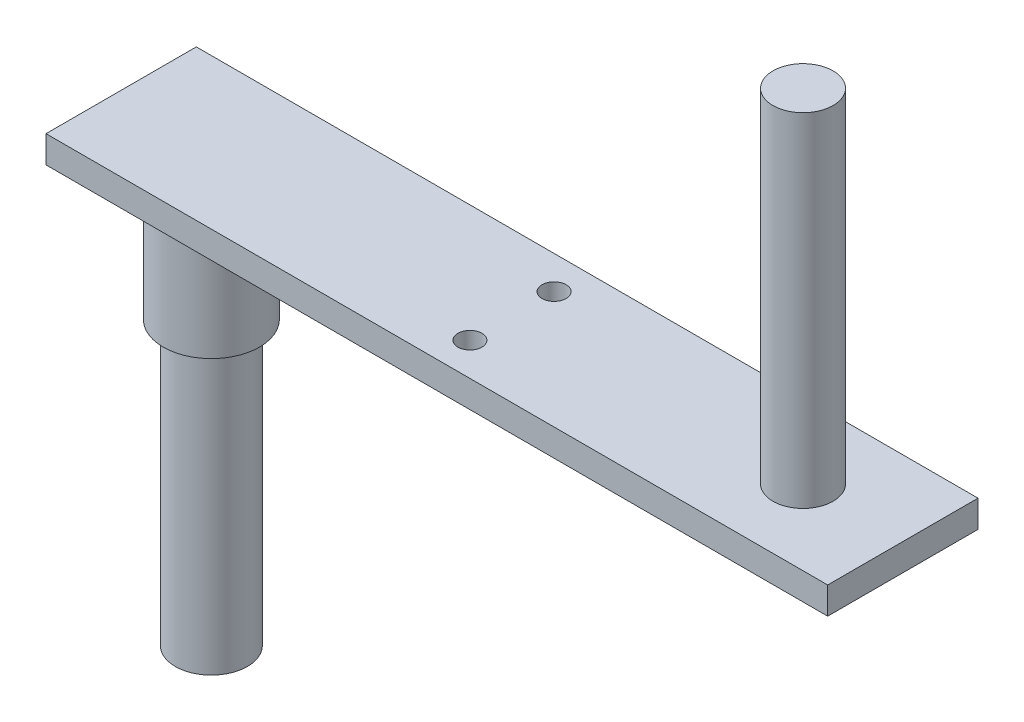
from build123d import *

# Parameters (mm, degrees)
SKETCH_1_W          = 130
SKETCH_1_H          = 25
EXTRUDE_1_DEPTH     = 4.5
SKETCH_2_R          = 5
EXTRUDE_2_DEPTH     = 57
SKETCH_3_R          = 8
EXTRUDE_3_DEPTH     = 21
SKETCH_4_R          = 6
EXTRUDE_4_DEPTH     = 47
CUT_EXTRUDE_1_REACH = 96.896
SKETCH_5_R          = 2


with BuildPart() as part:
    # Эскиз1 → Бобышка-Вытянуть1 (new body)
    with BuildSketch(Plane(origin=(0, 0, 0), x_dir=(1, 0, 0), z_dir=(0, 1, 0))):
        Rectangle(SKETCH_1_W, SKETCH_1_H)
    extrude(amount=EXTRUDE_1_DEPTH)

    # Эскиз2 → Бобышка-Вытянуть2 (add)
    with BuildSketch(Plane(origin=(0, 4.5, 0), x_dir=(1, 0, 0), z_dir=(0, 1, 0))):
        with Locations(Location((48.4, 0, 0), (0, 0, 90))):
            Circle(SKETCH_2_R)
    extrude(amount=EXTRUDE_2_DEPTH)

    # Эскиз3 → Бобышка-Вытянуть3 (add)
    with BuildSketch(Plane.XZ):
        with Locations(Location((-50, 0, 0), (0, 0, 90))):
            Circle(SKETCH_3_R)
    extrude(amount=EXTRUDE_3_DEPTH)

    # Эскиз4 → Бобышка-Вытянуть4 (add)
    with BuildSketch(Plane.XZ.offset(21)):
        with Locations(Location((-50, 0, 0), (0, 0, 270))):
            Circle(SKETCH_4_R)
    extrude(amount=EXTRUDE_4_DEPTH)

    # Эскиз5 → Вырез-Вытянуть1 (cut, up to next)
    with BuildSketch(Plane.XZ, mode=Mode.PRIVATE) as cut_extrude_1_sk1:
        with Locations(Location((0, 7, 0), (0, 0, 270))):
            Circle(SKETCH_5_R)
    cut_extrude_1_tool1 = extrude(cut_extrude_1_sk1.sketch, amount=-CUT_EXTRUDE_1_REACH, mode=Mode.PRIVATE) & part.part
    # Эскиз5 → Вырез-Вытянуть1 (cut, up to next)
    with BuildSketch(Plane.XZ, mode=Mode.PRIVATE) as cut_extrude_1_sk2:
        with Locations(Location((0, -7, 0), (0, 0, 270))):
            Circle(SKETCH_5_R)
    cut_extrude_1_tool2 = extrude(cut_extrude_1_sk2.sketch, amount=-CUT_EXTRUDE_1_REACH, mode=Mode.PRIVATE) & part.part
    add(cut_extrude_1_tool1.solids().sort_by_distance((0, 0, 7))[0], mode=Mode.SUBTRACT)
    add(cut_extrude_1_tool2.solids().sort_by_distance((0, 0, -7))[0], mode=Mode.SUBTRACT)


solid = part.part
